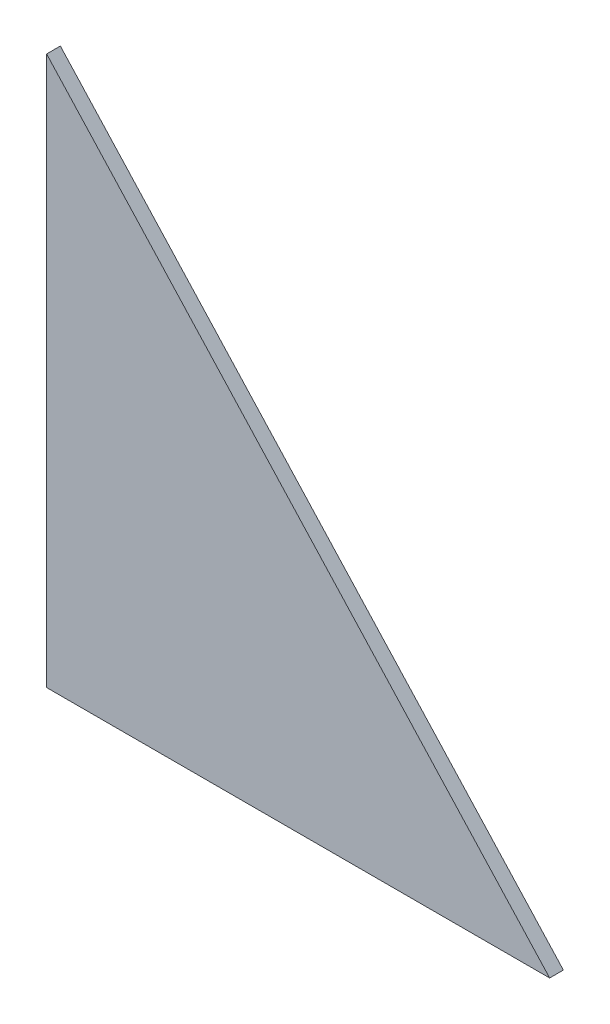
from build123d import *

# Parameters (mm, degrees)
RESSALTO_EXTRUS_O1_DEPTH = 1.5


with BuildPart() as part:
    # Esboço1 → Ressalto-extrusão1 (new body)
    with BuildSketch(Plane.XY):
        Polygon((0, 0), (0, 60), (55, 0), align=None)
    extrude(amount=RESSALTO_EXTRUS_O1_DEPTH)


solid = part.part
